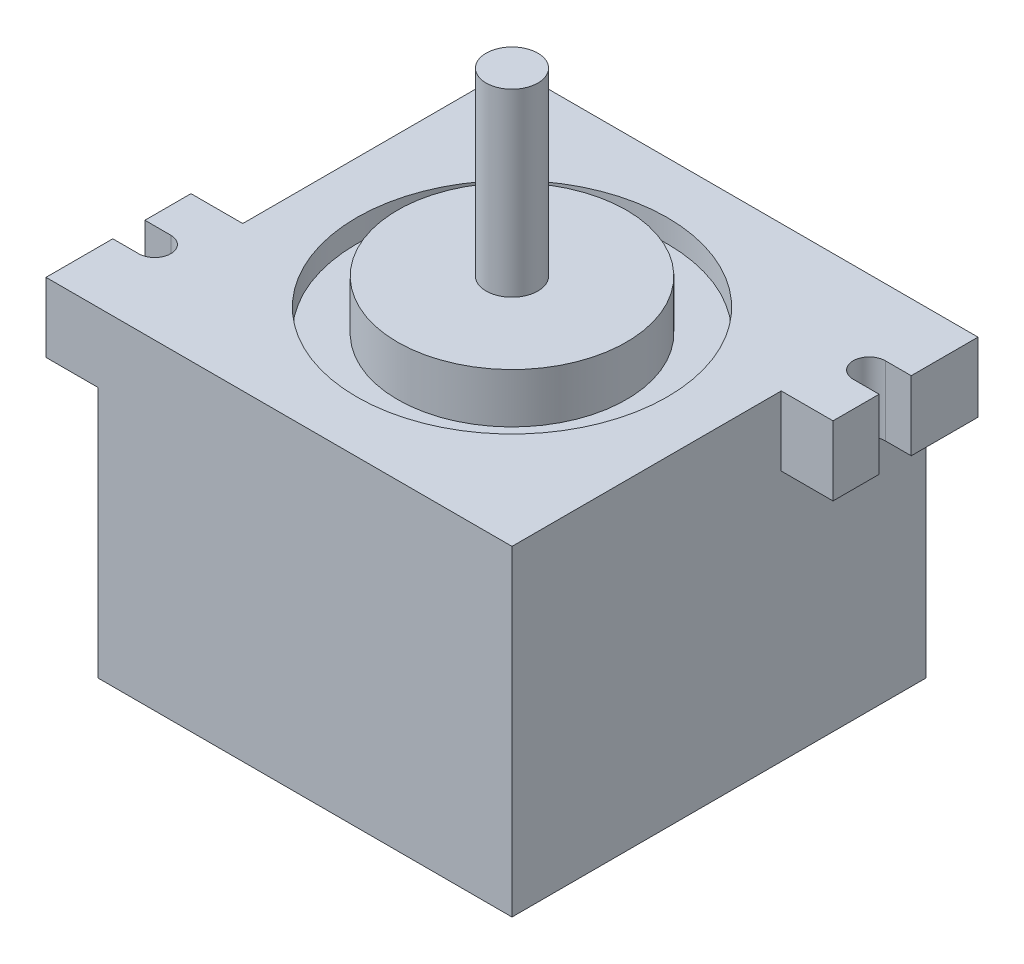
from build123d import *

# Parameters (mm, degrees)
SKETCH1_W           = 40
SKETCH1_H           = 40
BOSS_EXTRUDE1_DEPTH = 31
SKETCH2_R           = 15
CUT_EXTRUDE1_DEPTH  = 2.2
SKETCH3_R           = 11.05
BOSS_EXTRUDE2_DEPTH = 4.8
SKETCH4_R           = 2.5
BOSS_EXTRUDE3_DEPTH = 17.4
BOSS_EXTRUDE4_DEPTH = 6.7
CIRPATTERN1_COUNT   = 2
BOSS_EXTRUDE5_START = 0.5
SKETCH6_R           = 2.5
BOSS_EXTRUDE5_DEPTH = 0.5


with BuildPart() as part:
    # Sketch1 → Boss-Extrude1 (new body)
    with BuildSketch(Plane(origin=(0, 0, 0), x_dir=(1, 0, 0), z_dir=(0, 1, 0))):
        with Locations((20, 20)):
            Rectangle(SKETCH1_W, SKETCH1_H)
    extrude(amount=BOSS_EXTRUDE1_DEPTH)

    # Sketch2 → Cut-Extrude1 (cut)
    with BuildSketch(Plane(origin=(0, 31, 0), x_dir=(1, 0, 0), z_dir=(0, 1, 0))):
        with Locations((20, 20)):
            Circle(SKETCH2_R)
    extrude(amount=-CUT_EXTRUDE1_DEPTH, mode=Mode.SUBTRACT)

    # Sketch3 → Boss-Extrude2 (add)
    with BuildSketch(Plane(origin=(0, 28.8, 0), x_dir=(1, 0, 0), z_dir=(0, 1, 0))):
        with Locations((20, 20)):
            Circle(SKETCH3_R)
    extrude(amount=BOSS_EXTRUDE2_DEPTH)

    # Sketch4 → Boss-Extrude3 (add)
    with BuildSketch(Plane(origin=(0, 33.6, 0), x_dir=(1, 0, 0), z_dir=(0, 1, 0))):
        with Locations((20, 20)):
            Circle(SKETCH4_R)
    extrude(amount=BOSS_EXTRUDE3_DEPTH)

    # Sketch5 → Boss-Extrude4 (add)
    with BuildSketch(Plane(origin=(0, 31, 0), x_dir=(1, 0, 0), z_dir=(0, 1, 0))):
        with BuildLine():
            Line((40, 40), (45, 40))
            Line((45, 40), (45, 33.55))
            Line((45, 33.55), (42.5, 33.55))
            ThreePointArc((42.5, 33.55), (40.95, 32), (42.5, 30.45))
            Line((42.5, 30.45), (45, 30.45))
            Line((45, 30.45), (45, 26))
            Line((45, 26), (40, 26))
            Line((40, 26), (40, 40))
        make_face()
    boss_extrude4 = extrude(amount=-BOSS_EXTRUDE4_DEPTH)

    # CirPattern1: Boss-Extrude4 ×2 about axis
    cirpattern1_axis = Axis((20, 51, -20), (0, -1, 0))
    for i in range(1, CIRPATTERN1_COUNT):
        add(boss_extrude4.rotate(cirpattern1_axis, i * 360 / CIRPATTERN1_COUNT))

    # Sketch6 → Boss-Extrude5 (add)
    with BuildSketch(Plane.XZ.offset(BOSS_EXTRUDE5_START)):
        with Locations((20, -20)):
            Circle(SKETCH6_R)
    extrude(amount=-BOSS_EXTRUDE5_DEPTH)


solid = part.part
